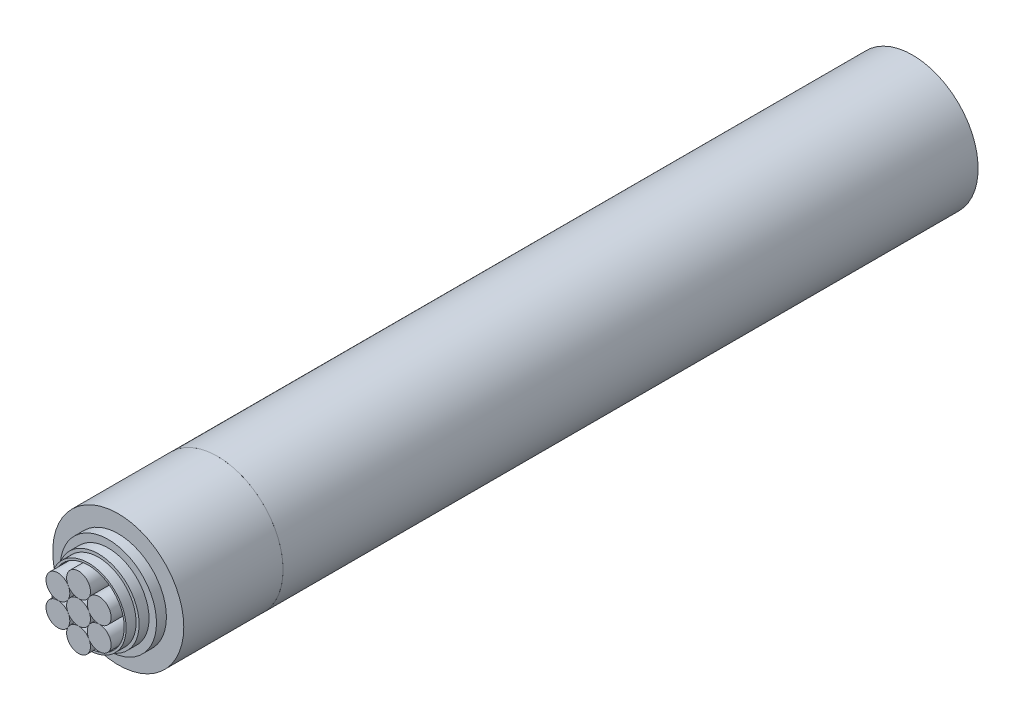
from build123d import *

# Parameters (mm, degrees)
IZIM1_R                       = 6.6
IZIM1_R_2                     = 4.85
Y_KSEKLIK_EKSTR_ZYON1_DEPTH   = 10
IZIM1_5_R                     = 4.85
IZIM1_5_R_2                   = 4.1
Y_KSEKLIK_EKSTR_ZYON2_DEPTH   = 11
IZIM1_6_R                     = 4.1
IZIM1_6_R_2                   = 3.8
Y_KSEKLIK_EKSTR_ZYON3_DEPTH   = 12
IZIM1_7_R                     = 3.8
Y_KSEKLIK_EKSTR_ZYON4_DEPTH   = 13
Y_KSEKLIK_EKSTR_ZYON5_DEPTH   = 14
Y_KSEKLIK_EKSTR_ZYON5_2_DEPTH = 14
Y_KSEKLIK_EKSTR_ZYON5_3_DEPTH = 14
Y_KSEKLIK_EKSTR_ZYON5_4_DEPTH = 14
Y_KSEKLIK_EKSTR_ZYON5_5_DEPTH = 14
Y_KSEKLIK_EKSTR_ZYON5_6_DEPTH = 14
Y_KSEKLIK_EKSTR_ZYON5_7_DEPTH = 14
L_EK6_SCALE                   = 0.5
IZIM3_R                       = 3.3
Y_KSEKLIK_EKSTR_ZYON8_DEPTH   = 35


with BuildPart() as part:
    # Çizim1 → Yükseklik-Ekstrüzyon1 (new body)
    with BuildSketch(Plane.XY):
        Circle(IZIM1_R)
        Circle(IZIM1_R_2, mode=Mode.SUBTRACT)
    extrude(amount=Y_KSEKLIK_EKSTR_ZYON1_DEPTH)

    # Çizim1<5> → Yükseklik-Ekstrüzyon2 (add)
    with BuildSketch(Plane.XY):
        Circle(IZIM1_5_R)
        Circle(IZIM1_5_R_2, mode=Mode.SUBTRACT)
    extrude(amount=Y_KSEKLIK_EKSTR_ZYON2_DEPTH)

    # Çizim1<6> → Yükseklik-Ekstrüzyon3 (add)
    with BuildSketch(Plane.XY):
        Circle(IZIM1_6_R)
        Circle(IZIM1_6_R_2, mode=Mode.SUBTRACT)
    extrude(amount=Y_KSEKLIK_EKSTR_ZYON3_DEPTH)

    # Çizim1<7> → Yükseklik-Ekstrüzyon4 (add)
    with BuildSketch(Plane.XY):
        Circle(IZIM1_7_R)
        with BuildLine():
            ThreePointArc((1e-09, 3.6), (1.799999837, 3.117691548), (3.117691265, 1.800000327))
            ThreePointArc((3.117691265, 1.800000327), (3.477332926, 0.931748744), (3.6, 0))
            ThreePointArc((3.6, 0), (3.477333, -0.931748466), (3.117691553, -1.799999828))
            ThreePointArc((3.117691553, -1.799999828), (1.800000078, -3.117691408), (-1.8e-08, -3.6))
            ThreePointArc((-1.8e-08, -3.6), (-1.800000027, -3.117691438), (-3.117691475, -1.799999962))
            ThreePointArc((-3.117691475, -1.799999962), (-3.6, 2.09e-07), (-3.117691266, 1.800000324))
            ThreePointArc((-3.117691266, 1.800000324), (-1.799999837, 3.117691547), (1e-09, 3.6))
        make_face(mode=Mode.SUBTRACT)
    extrude(amount=Y_KSEKLIK_EKSTR_ZYON4_DEPTH)


with BuildPart() as body_2:
    # Çizim1<8> → Yükseklik-Ekstrüzyon5 (new body)
    with BuildSketch(Plane.XY):
        with BuildLine():
            ThreePointArc((1.039230332, -0.600000264), (1.2, -2.6e-08), (1.039230358, 0.600000219))
            ThreePointArc((1.039230358, 0.600000219), (0.599999889, 1.039230548), (-2e-09, 1.2))
            ThreePointArc((-2e-09, 1.2), (-0.599999999, 1.039230485), (-1.039230482, 0.600000005))
            ThreePointArc((-1.039230482, 0.600000005), (-1.2, 6.3e-08), (-1.039230545, -0.599999895))
            ThreePointArc((-1.039230545, -0.599999895), (-0.600000053, -1.039230454), (0, -1.2))
            ThreePointArc((0, -1.2), (0.599999868, -1.039230561), (1.039230332, -0.600000264))
        make_face()
    extrude(amount=Y_KSEKLIK_EKSTR_ZYON5_DEPTH)


with BuildPart() as body_3:
    # Çizim1<8> → Y_kseklik-Ekstr_zyon5 2 (new body)
    with BuildSketch(Plane.XY):
        with BuildLine():
            ThreePointArc((1.039230359, 1.799999783), (0.878460969, 1.200000001), (1.039230358, 0.600000219))
            ThreePointArc((1.039230358, 0.600000219), (1.47846086, 0.160769579), (2.078460969, 0))
            ThreePointArc((2.078460969, 0), (3.117691391, 1.800000109), (1.039230359, 1.799999783))
        make_face()
    extrude(amount=Y_KSEKLIK_EKSTR_ZYON5_2_DEPTH)


with BuildPart() as body_4:
    # Çizim1<8> → Y_kseklik-Ekstr_zyon5 3 (new body)
    with BuildSketch(Plane.XY):
        with BuildLine():
            ThreePointArc((2.078460969, 0), (1.478460837, -0.160769592), (1.039230332, -0.600000264))
            ThreePointArc((1.039230332, -0.600000264), (0.878460969, -1.20000028), (1.039230612, -1.800000221))
            ThreePointArc((1.039230612, -1.800000221), (3.117691518, -1.799999889), (2.078460969, 0))
        make_face()
    extrude(amount=Y_KSEKLIK_EKSTR_ZYON5_3_DEPTH)


with BuildPart() as body_5:
    # Çizim1<8> → Y_kseklik-Ekstr_zyon5 4 (new body)
    with BuildSketch(Plane.XY):
        with BuildLine():
            ThreePointArc((-1.039230399, 1.799999852), (-0.599999927, 1.360769473), (-2e-09, 1.2))
            ThreePointArc((-2e-09, 1.2), (0.59999989, 1.360769452), (1.039230359, 1.799999783))
            ThreePointArc((1.039230359, 1.799999783), (4e-08, 3.6), (-1.039230399, 1.799999852))
        make_face()
    extrude(amount=Y_KSEKLIK_EKSTR_ZYON5_4_DEPTH)


with BuildPart() as body_6:
    # Çizim1<8> → Y_kseklik-Ekstr_zyon5 5 (new body)
    with BuildSketch(Plane.XY):
        with BuildLine():
            ThreePointArc((1.039230612, -1.800000221), (0.600000111, -1.360769579), (0, -1.2))
            ThreePointArc((0, -1.2), (-0.59999994, -1.360769481), (-1.039230415, -1.79999988))
            ThreePointArc((-1.039230415, -1.79999988), (-1.97e-07, -3.6), (1.039230612, -1.800000221))
        make_face()
    extrude(amount=Y_KSEKLIK_EKSTR_ZYON5_5_DEPTH)


with BuildPart() as body_7:
    # Çizim1<8> → Y_kseklik-Ekstr_zyon5 6 (new body)
    with BuildSketch(Plane.XY):
        with BuildLine():
            ThreePointArc((-2.078460966, 0), (-1.478460966, 0.160769517), (-1.039230482, 0.600000005))
            ThreePointArc((-1.039230482, 0.600000005), (-0.878460969, 1.199999917), (-1.039230399, 1.799999852))
            ThreePointArc((-1.039230399, 1.799999852), (-3.117691412, 1.800000073), (-2.078460966, 0))
        make_face()
    extrude(amount=Y_KSEKLIK_EKSTR_ZYON5_6_DEPTH)


with BuildPart() as body_8:
    # Çizim1<8> → Y_kseklik-Ekstr_zyon5 7 (new body)
    with BuildSketch(Plane.XY):
        with BuildLine():
            ThreePointArc((-1.039230415, -1.79999988), (-0.878460969, -1.19999987), (-1.039230545, -0.599999895))
            ThreePointArc((-1.039230545, -0.599999895), (-1.47846102, -0.160769486), (-2.078460966, 0))
            ThreePointArc((-2.078460966, 0), (-3.11769142, -1.800000059), (-1.039230415, -1.79999988))
        make_face()
    extrude(amount=Y_KSEKLIK_EKSTR_ZYON5_7_DEPTH)


with BuildPart() as body_4_1:
    # Ölçek6: scaled about (0, 0, 0)
    add(body_4.part.scale(L_EK6_SCALE))


with BuildPart() as body_6_1:
    # Ölçek6: scaled about (0, 0, 0)
    add(body_6.part.scale(L_EK6_SCALE))


with BuildPart() as body_8_1:
    # Ölçek6: scaled about (0, 0, 0)
    add(body_8.part.scale(L_EK6_SCALE))


with BuildPart() as body_7_1:
    # Ölçek6: scaled about (0, 0, 0)
    add(body_7.part.scale(L_EK6_SCALE))


with BuildPart() as body_2_1:
    # Ölçek6: scaled about (0, 0, 0)
    add(body_2.part.scale(L_EK6_SCALE))


with BuildPart() as body_3_1:
    # Ölçek6: scaled about (0, 0, 0)
    add(body_3.part.scale(L_EK6_SCALE))


with BuildPart() as body_5_1:
    # Ölçek6: scaled about (0, 0, 0)
    add(body_5.part.scale(L_EK6_SCALE))


with BuildPart() as part_1:
    # Ölçek6: scaled about (0, 0, 0)
    add(part.part.scale(L_EK6_SCALE))


with BuildPart() as body_9:
    # Çizim3 → Yükseklik-Ekstrüzyon8 (new body)
    with BuildSketch(Plane(origin=(0, 0, 0), x_dir=(-1, 0, 0), z_dir=(0, 0, -1))):
        Circle(IZIM3_R)
    extrude(amount=Y_KSEKLIK_EKSTR_ZYON8_DEPTH)


solid = Compound([body_4_1.part, body_6_1.part, body_8_1.part, body_7_1.part, body_2_1.part, body_3_1.part, body_5_1.part, part_1.part, body_9.part])
